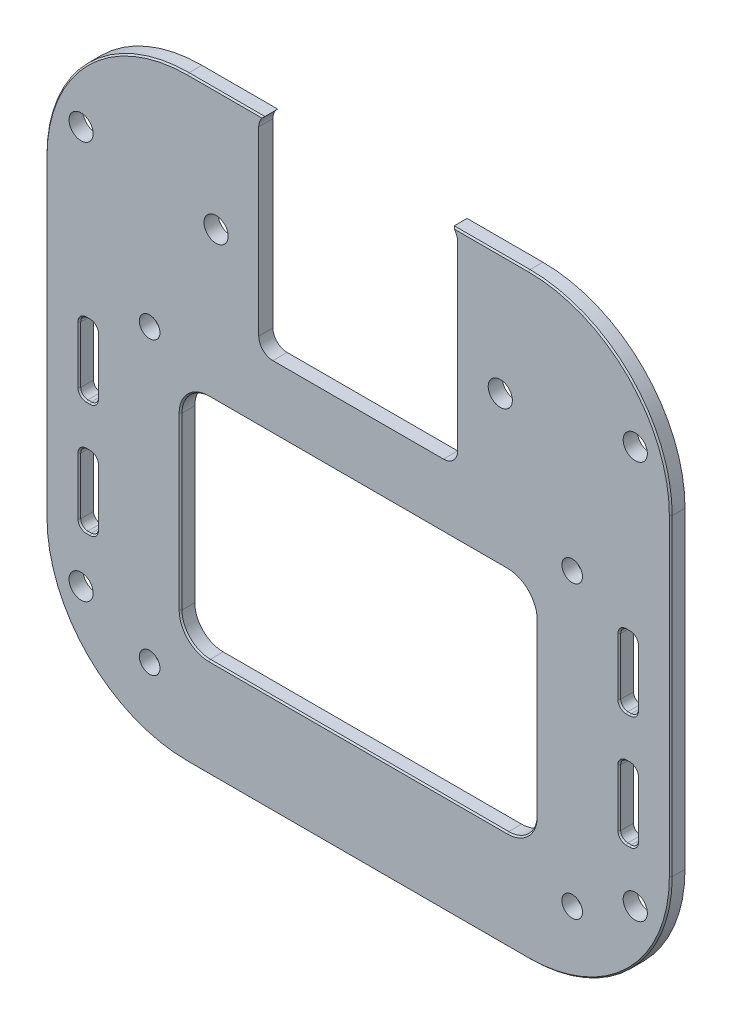
from build123d import *

# Parameters (mm, degrees)
SKETCH_219_R           = 1.45
SKETCH_219_R_2         = 1.7
EXTRUDE_2_DEPTH        = 2
CUT_EXTRUDE_641_DEPTH  = 61.860496219
CUT_EXTRUDE_1124_DEPTH = 61.860496219
CHAMFER_C0_2_SIZE      = 0.2
CUT_EXTRUDE_2015_DEPTH = 61.860496219
SKETCH_M3_R            = 1.7
CUT_EXTRUDE_2116_DEPTH = 61.860496219


with BuildPart() as part:
    # Sketch 219 → 屏幕承架厚2 (new body)
    with BuildSketch(Plane.XY):
        with BuildLine():
            Line((-24, -42), (24, -42))
            ThreePointArc((24, -42), (38.142135624, -36.142135624), (44, -22))
            Line((44, -22), (44, 22))
            ThreePointArc((44, 22), (38.142135624, 36.142135624), (24, 42))
            Line((24, 42), (-24, 42))
            ThreePointArc((-24, 42), (-38.142135624, 36.142135624), (-44, 22))
            Line((-44, 22), (-44, -22))
            ThreePointArc((-44, -22), (-38.142135624, -36.142135624), (-24, -42))
        make_face()
        with Locations((-29.35, 8.45)):
            Circle(SKETCH_219_R, mode=Mode.SUBTRACT)
        with Locations((-29.35, -32.45)):
            Circle(SKETCH_219_R, mode=Mode.SUBTRACT)
        with Locations((30.12, 8.45)):
            Circle(SKETCH_219_R, mode=Mode.SUBTRACT)
        with Locations((30.12, -32.45)):
            Circle(SKETCH_219_R, mode=Mode.SUBTRACT)
        with Locations((-39, -28)):
            Circle(SKETCH_219_R_2, mode=Mode.SUBTRACT)
        with Locations((-39, 28)):
            Circle(SKETCH_219_R_2, mode=Mode.SUBTRACT)
        with Locations((39, -28)):
            Circle(SKETCH_219_R_2, mode=Mode.SUBTRACT)
        with Locations((39, 28)):
            Circle(SKETCH_219_R_2, mode=Mode.SUBTRACT)
        with BuildLine():
            Line((-21, -28), (21, -28))
            ThreePointArc((21, -28), (23.828427125, -26.828427125), (25, -24))
            Line((25, -24), (25, 0))
            ThreePointArc((25, 0), (23.828427125, 2.828427125), (21, 4))
            Line((21, 4), (-21, 4))
            ThreePointArc((-21, 4), (-23.828427125, 2.828427125), (-25, 0))
            Line((-25, 0), (-25, -24))
            ThreePointArc((-25, -24), (-23.828427125, -26.828427125), (-21, -28))
        make_face(mode=Mode.SUBTRACT)
    extrude(amount=EXTRUDE_2_DEPTH)

    # 摄像板可换安装区26乘25 → Cut-Extrude 641 (cut, through all)
    with BuildSketch(Plane.XY):
        with BuildLine():
            Line((-11, 17.5), (11, 17.5))
            ThreePointArc((11, 17.5), (12.414213562, 18.085786438), (13, 19.5))
            Line((13, 19.5), (13, 40.5))
            ThreePointArc((13, 40.5), (12.414213562, 41.914213562), (11, 42.5))
            Line((11, 42.5), (-11, 42.5))
            ThreePointArc((-11, 42.5), (-12.414213562, 41.914213562), (-13, 40.5))
            Line((-13, 40.5), (-13, 19.5))
            ThreePointArc((-13, 19.5), (-12.414213562, 18.085786438), (-11, 17.5))
        make_face()
    extrude(amount=CUT_EXTRUDE_641_DEPTH, mode=Mode.SUBTRACT)

    # Sketch 697 → Cut-Extrude 1124 (cut, through all)
    with BuildSketch(Plane.XY):
        with BuildLine():
            Line((-38.25, -21), (-37.75, -21))
            ThreePointArc((-37.75, -21), (-37.042893219, -20.707106781), (-36.75, -20))
            Line((-36.75, -20), (-36.75, -12))
            ThreePointArc((-36.75, -12), (-37.042893219, -11.292893219), (-37.75, -11))
            Line((-37.75, -11), (-38.25, -11))
            ThreePointArc((-38.25, -11), (-38.957106781, -11.292893219), (-39.25, -12))
            Line((-39.25, -12), (-39.25, -20))
            ThreePointArc((-39.25, -20), (-38.957106781, -20.707106781), (-38.25, -21))
        make_face()
        with BuildLine():
            Line((-38.25, -5), (-37.75, -5))
            ThreePointArc((-37.75, -5), (-37.042893219, -4.707106781), (-36.75, -4))
            Line((-36.75, -4), (-36.75, 4))
            ThreePointArc((-36.75, 4), (-37.042893219, 4.707106781), (-37.75, 5))
            Line((-37.75, 5), (-38.25, 5))
            ThreePointArc((-38.25, 5), (-38.957106781, 4.707106781), (-39.25, 4))
            Line((-39.25, 4), (-39.25, -4))
            ThreePointArc((-39.25, -4), (-38.957106781, -4.707106781), (-38.25, -5))
        make_face()
        with BuildLine():
            Line((37.75, -21), (38.25, -21))
            ThreePointArc((38.25, -21), (38.957106781, -20.707106781), (39.25, -20))
            Line((39.25, -20), (39.25, -12))
            ThreePointArc((39.25, -12), (38.957106781, -11.292893219), (38.25, -11))
            Line((38.25, -11), (37.75, -11))
            ThreePointArc((37.75, -11), (37.042893219, -11.292893219), (36.75, -12))
            Line((36.75, -12), (36.75, -20))
            ThreePointArc((36.75, -20), (37.042893219, -20.707106781), (37.75, -21))
        make_face()
        with BuildLine():
            Line((37.75, -5), (38.25, -5))
            ThreePointArc((38.25, -5), (38.957106781, -4.707106781), (39.25, -4))
            Line((39.25, -4), (39.25, 4))
            ThreePointArc((39.25, 4), (38.957106781, 4.707106781), (38.25, 5))
            Line((38.25, 5), (37.75, 5))
            ThreePointArc((37.75, 5), (37.042893219, 4.707106781), (36.75, 4))
            Line((36.75, 4), (36.75, -4))
            ThreePointArc((36.75, -4), (37.042893219, -4.707106781), (37.75, -5))
        make_face()
    extrude(amount=CUT_EXTRUDE_1124_DEPTH, mode=Mode.SUBTRACT)

    # 非功能外缘倒角_C0.2
    chamfer_c0_2_edges = [part.edges().sort_by_distance(p)[0] for p in [
        (38.142135624, -36.142135624, 2),
        (-38.957106781, -4.707106781, 2),
        (-38, -5, 2),
        (-37.042893219, -4.707106781, 2),
        (-36.75, 0, 2),
        (-37.042893219, 4.707106781, 2),
        (-38, 5, 2),
        (-38.957106781, 4.707106781, 2),
        (-39.25, 0, 2),
        (37.042893219, -20.707106781, 2),
        (38, -21, 2),
        (38.957106781, -20.707106781, 2),
        (39.25, -16, 2),
        (38.957106781, -11.292893219, 2),
        (38, -11, 2),
        (37.042893219, -11.292893219, 2),
        (36.75, -16, 2),
        (44, 0, 2),
        (37.042893219, -4.707106781, 2),
        (38, -5, 2),
        (38.957106781, -4.707106781, 2),
        (39.25, 0, 2),
        (38.957106781, 4.707106781, 2),
        (38, 5, 2),
        (37.042893219, 4.707106781, 2),
        (36.75, 0, 2),
        (-38.957106781, -20.707106781, 2),
        (-38, -21, 2),
        (-37.042893219, -20.707106781, 2),
        (-36.75, -16, 2),
        (-37.042893219, -11.292893219, 2),
        (-38, -11, 2),
        (-38.957106781, -11.292893219, 2),
        (-39.25, -16, 2),
        (38.142135624, 36.142135624, 2),
        (18.161437828, 42, 2),
        (-38.142135624, 36.142135624, 2),
        (-23.828427125, -26.828427125, 2),
        (0, -28, 2),
        (23.828427125, -26.828427125, 2),
        (25, -12, 2),
        (23.828427125, 2.828427125, 2),
        (0, 4, 2),
        (-23.828427125, 2.828427125, 2),
        (-44, 0, 2),
        (-25, -12, 2),
        (-38.142135624, -36.142135624, 2),
        (-18.161437828, 42, 2),
        (0, -42, 2),
        (12.822875656, 41.322875656, 2),
        (-12.822875656, 41.322875656, 2),
        (-13, 30, 2),
        (-12.414213562, 18.085786438, 2),
        (0, 17.5, 2),
        (12.414213562, 18.085786438, 2),
        (13, 30, 2),
    ]]
    chamfer(chamfer_c0_2_edges, length=CHAMFER_C0_2_SIZE)

    # 相机螺母与后插座避空28乘29_5 → Cut-Extrude 2015 (cut, through all)
    with BuildSketch(Plane.XY):
        with BuildLine():
            Line((-12, 13), (12, 13))
            ThreePointArc((12, 13), (13.414213562, 13.585786438), (14, 15))
            Line((14, 15), (14, 40.5))
            ThreePointArc((14, 40.5), (13.414213562, 41.914213562), (12, 42.5))
            Line((12, 42.5), (-12, 42.5))
            ThreePointArc((-12, 42.5), (-13.414213562, 41.914213562), (-14, 40.5))
            Line((-14, 40.5), (-14, 15))
            ThreePointArc((-14, 15), (-13.414213562, 13.585786438), (-12, 13))
        make_face()
    extrude(amount=CUT_EXTRUDE_2015_DEPTH, mode=Mode.SUBTRACT)

    # 相机托架双M3连接孔 → Cut-Extrude 2116 (cut, through all)
    with BuildSketch(Plane.XY):
        with Locations((-20, 25)):
            Circle(SKETCH_M3_R)
        with Locations((20, 25)):
            Circle(SKETCH_M3_R)
    extrude(amount=CUT_EXTRUDE_2116_DEPTH, mode=Mode.SUBTRACT)


solid = part.part
